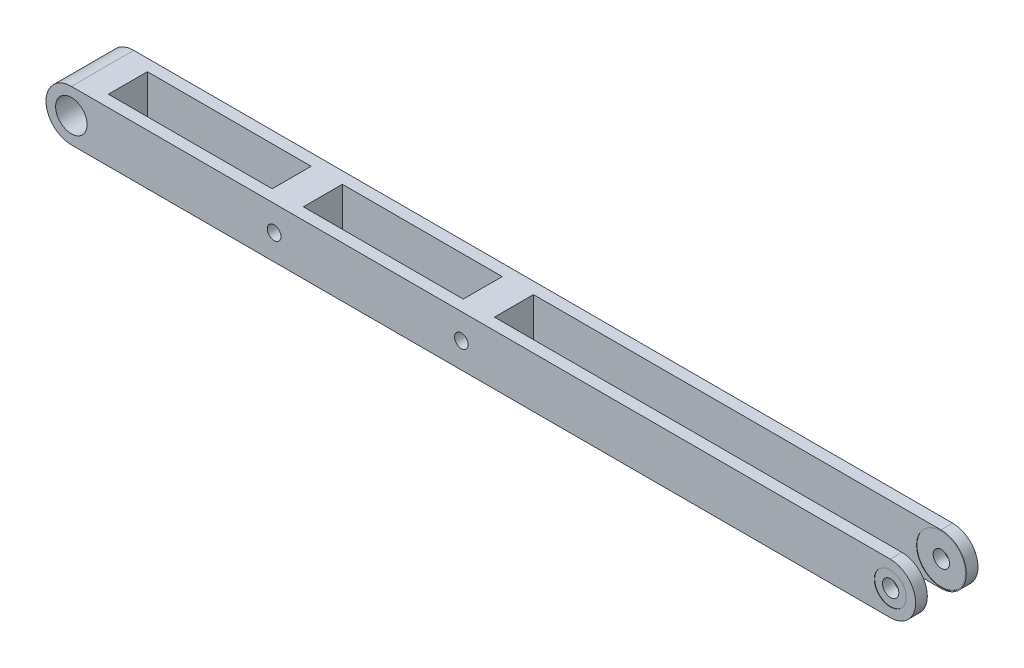
from build123d import *

# Parameters (mm, degrees)
SKETCH_1_R          = 4.04
SKETCH_1_R_2        = 1.75
SKETCH_1_R_3        = 2.1
EXTRUDE_1_DEPTH     = 16
SKETCH_2_W          = 42
SKETCH_2_H          = 10
SKETCH_2_W_2        = 41
CUT_EXTRUDE_1_DEPTH = 218.479309361
SKETCH_3_R          = 4.1
A_0P1_DEPTH         = 0.1
B_0P1_START         = -0.1
SKETCH_4_R          = 4.1
B_0P1_DEPTH         = 0.1
SKETCH_5_R          = 6.25
A_0P1_2_DEPTH       = 0.1
SKETCH_6_R          = 6.25
B_0P1_2_DEPTH       = 0.1


with BuildPart() as part:
    # 草图1 → 凸台-拉伸1 (new body)
    with BuildSketch(Plane.XY):
        with BuildLine():
            Line((0, 6.5), (210, 6.5))
            ThreePointArc((210, 6.5), (216.5, 0), (210, -6.5))
            Line((210, -6.5), (0, -6.5))
            ThreePointArc((0, -6.5), (-6.5, 0), (0, 6.5))
        make_face()
        Circle(SKETCH_1_R, mode=Mode.SUBTRACT)
        with Locations((100, 0)):
            Circle(SKETCH_1_R_2, mode=Mode.SUBTRACT)
        with Locations((210, 0)):
            Circle(SKETCH_1_R_3, mode=Mode.SUBTRACT)
        with Locations((52, 0)):
            Circle(SKETCH_1_R_2, mode=Mode.SUBTRACT)
    extrude(amount=-EXTRUDE_1_DEPTH)

    # 草图2 → 切除-拉伸1 (cut, through all)
    with BuildSketch(Plane.XZ.offset(6.5)):
        Polygon((148.5, -3), (153.5, -3), (216.5, -3), (216.5, -13), (153.5, -13), (148.5, -13), (105.5, -13), (105.5, -3), align=None)
        with Locations((27.5, -8)):
            Rectangle(SKETCH_2_W, SKETCH_2_H)
        with Locations((77, -8)):
            Rectangle(SKETCH_2_W_2, SKETCH_2_H)
    extrude(amount=-CUT_EXTRUDE_1_DEPTH, mode=Mode.SUBTRACT)

    # 草图3 → A__0p1 (cut)
    with BuildSketch(Plane.XY):
        with Locations((210, 0)):
            Circle(SKETCH_3_R)
    extrude(amount=-A_0P1_DEPTH, mode=Mode.SUBTRACT)

    # 草图4 → B__0p1 (cut)
    with BuildSketch(Plane(origin=(0, 0, -16), x_dir=(-1, 0, 0), z_dir=(0, 0, -1)).offset(B_0P1_START)):
        with Locations(Location((-210, 0, 0), (0, 0, 180))):
            Circle(SKETCH_4_R)
    extrude(amount=B_0P1_DEPTH, mode=Mode.SUBTRACT)

    # 草图5 → A__0p1 2 (cut)
    with BuildSketch(Plane(origin=(0, 0, -3), x_dir=(-1, 0, 0), z_dir=(0, 0, -1))):
        with Locations((-210, 0)):
            Circle(SKETCH_5_R)
    extrude(amount=-A_0P1_2_DEPTH, mode=Mode.SUBTRACT)

    # 草图6 → B__0p1 2 (cut)
    with BuildSketch(Plane.XY.offset(-13).offset(B_0P1_START)):
        with Locations(Location((210, 0, 0), (0, 0, 180))):
            Circle(SKETCH_6_R)
    extrude(amount=B_0P1_2_DEPTH, mode=Mode.SUBTRACT)


solid = part.part
